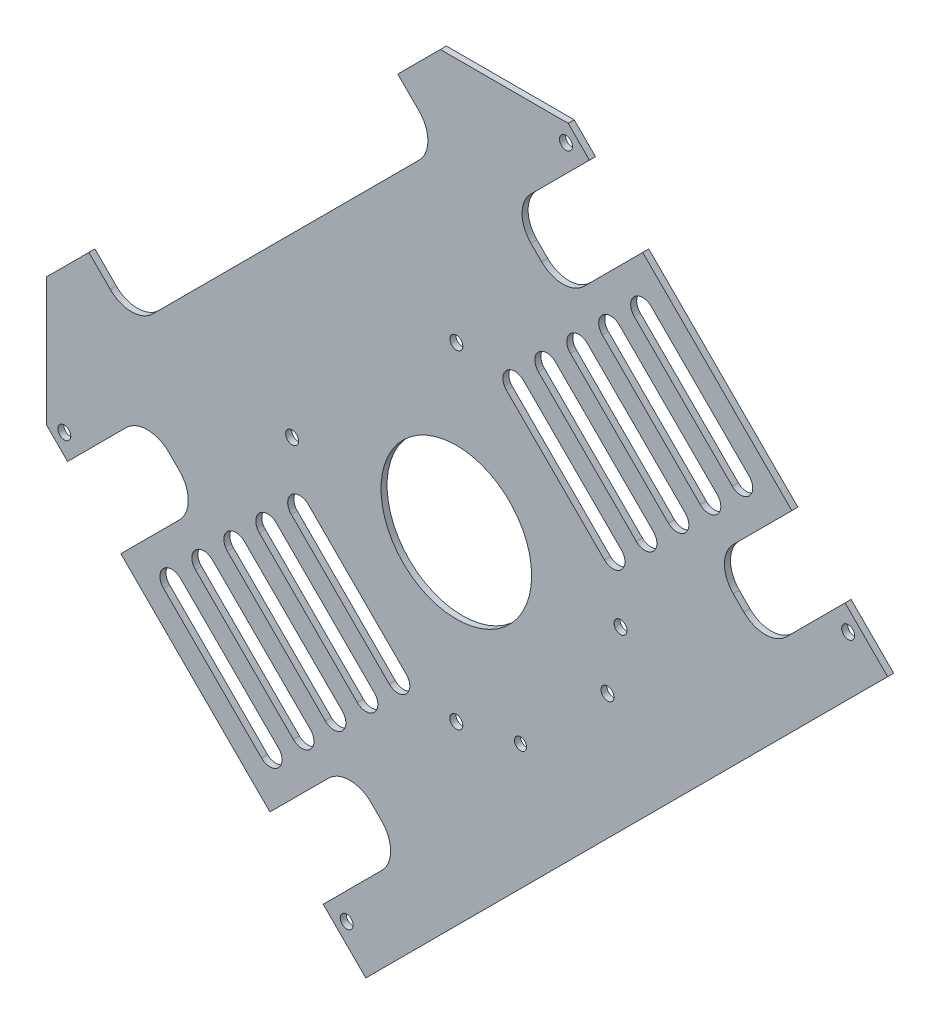
from build123d import *

# Parameters (mm, degrees)
SKETCH1_R          = 2.15
SKETCH1_R_2        = 2
EXTRUDE1_DEPTH     = 2
FILLET1_R          = 10
FILLET2_R          = 10
CHAMFER1_SIZE      = 30
SKETCH3_R          = 2.15
CUT_EXTRUDE1_DEPTH = 3
CUT_EXTRUDE2_DEPTH = 10


with BuildPart() as part:
    # Sketch1 → Extrude1 (new body)
    # profile 1 of 2: a face of its own
    with BuildSketch(Plane.XY):
        with BuildLine():
            Line((-17.67766953, 17.67766953), (-56.568542495, 56.568542495))
            Line((-56.568542495, 56.568542495), (-107.833729857, 5.303355133))
            Line((-107.833729857, 5.303355133), (-121.975865481, 19.445490757))
            Line((-121.975865481, 19.445490757), (-157.33120454, -15.909848303))
            Line((-157.33120454, -15.909848303), (-129.046933293, -44.19411955))
            Line((-129.046933293, -44.19411955), (-102.530428998, -17.677615256))
            Line((-102.530428998, -17.677615256), (-84.852759469, -35.355284785))
            Line((-84.852759469, -35.355284785), (-111.369263763, -61.87178908))
            Line((-111.369263763, -61.87178908), (-110.869178063, -62.37187478))
            Line((-110.869178063, -62.37187478), (-61.87178908, -111.369263763))
            Line((-61.87178908, -111.369263763), (-35.355284785, -84.852759468))
            Line((-35.355284785, -84.852759468), (-17.677615256, -102.530428998))
            Line((-17.677615256, -102.530428998), (-44.19411955, -129.046933293))
            Line((-44.19411955, -129.046933293), (-30.051983927, -143.189068916))
            Line((-30.051983927, -143.189068916), (56.568542495, -56.568542495))
            Line((56.568542495, -56.568542495), (17.67766953, -17.67766953))
            ThreePointArc((17.67766953, -17.67766953), (-17.67766953, -17.67766953), (-17.67766953, 17.67766953))
        make_face()
        with Locations((-54.5, 0)):
            Circle(SKETCH1_R, mode=Mode.SUBTRACT)
        with Locations((0, -54.5)):
            Circle(SKETCH1_R, mode=Mode.SUBTRACT)
        with Locations((21.294846503, -50.167514513)):
            Circle(SKETCH1_R_2, mode=Mode.SUBTRACT)
    # profile 2 of 2: a face of its own
    with BuildSketch(Plane.XY):
        with BuildLine():
            Line((17.677615256, 102.530428998), (44.19411955, 129.046933293))
            Line((44.19411955, 129.046933293), (15.909848303, 157.33120454))
            Line((15.909848303, 157.33120454), (-19.445490757, 121.975865481))
            Line((-19.445490757, 121.975865481), (-5.303355133, 107.833729857))
            Line((-5.303355133, 107.833729857), (-56.568542495, 56.568542495))
            Line((-56.568542495, 56.568542495), (-17.67766953, 17.67766953))
            ThreePointArc((-17.67766953, 17.67766953), (9.567085809, 23.096988313), (25, 0))
            ThreePointArc((25, 0), (23.096988313, -9.567085809), (17.67766953, -17.67766953))
            Line((17.67766953, -17.67766953), (56.568542495, -56.568542495))
            Line((56.568542495, -56.568542495), (143.189068916, 30.051983927))
            Line((143.189068916, 30.051983927), (129.046933293, 44.19411955))
            Line((129.046933293, 44.19411955), (102.530428998, 17.677615256))
            Line((102.530428998, 17.677615256), (84.852759469, 35.355284785))
            Line((84.852759469, 35.355284785), (111.369263763, 61.87178908))
            Line((111.369263763, 61.87178908), (61.87178908, 111.369263763))
            Line((61.87178908, 111.369263763), (35.355284785, 84.852759469))
            Line((35.355284785, 84.852759469), (17.677615256, 102.530428998))
        make_face()
        with Locations((50.167514513, -21.294846503)):
            Circle(SKETCH1_R, mode=Mode.SUBTRACT)
        with Locations((54.5, 0)):
            Circle(SKETCH1_R, mode=Mode.SUBTRACT)
        with Locations((0, 54.5)):
            Circle(SKETCH1_R, mode=Mode.SUBTRACT)
    extrude(amount=EXTRUDE1_DEPTH)

    # Fillet1
    fillet1_edges = [part.edges().sort_by_distance(p)[0] for p in [
        (-107.833729857, 5.303355133, 1),
        (-5.303355133, 107.833729857, 1),
    ]]
    fillet(fillet1_edges, radius=FILLET1_R)

    # Fillet2
    fillet2_edges = [part.edges().sort_by_distance(p)[0] for p in [
        (-17.677615256, -102.530428998, 1),
        (-35.355284785, -84.852759468, 1),
        (-84.852759469, -35.355284785, 1),
        (-102.530428998, -17.677615256, 1),
        (17.677615256, 102.530428998, 1),
        (35.355284785, 84.852759469, 1),
        (84.852759469, 35.355284785, 1),
        (102.530428998, 17.677615256, 1),
    ]]
    fillet(fillet2_edges, radius=FILLET2_R)

    # Chamfer1
    chamfer1_edges = [part.edges().sort_by_distance(p)[0] for p in [
        (-157.33120454, -15.909848303, 1),
        (15.909848303, 157.33120454, 1),
    ]]
    chamfer(chamfer1_edges, length=CHAMFER1_SIZE)

    # Sketch3 → Cut-Extrude1 (cut)
    with BuildSketch(Plane.XY.offset(2)):
        with Locations((130.064043572, 36.323458724)):
            Circle(SKETCH3_R)
        with Locations((36.394169402, 130.13475425)):
            Circle(SKETCH3_R)
        with Locations((-36.3941694, -130.134754248)):
            Circle(SKETCH3_R)
        with Locations((-130.13475425, -36.394169402)):
            Circle(SKETCH3_R)
    extrude(amount=-CUT_EXTRUDE1_DEPTH, mode=Mode.SUBTRACT)

    # Sketch4 → Cut-Extrude2 (cut)
    with BuildSketch(Plane.XY.offset(2)):
        with BuildLine():
            Line((64.700216205, 97.227128139), (97.227128139, 64.700216205))
            ThreePointArc((97.227128139, 64.700216205), (97.227128139, 59.043361955), (91.57027389, 59.043361955))
            Line((91.57027389, 59.043361955), (59.043361955, 91.57027389))
            ThreePointArc((59.043361955, 91.57027389), (59.043361955, 97.227128139), (64.700216205, 97.227128139))
        make_face()
        with BuildLine():
            Line((54.093614487, 86.620526421), (86.620526421, 54.093614487))
            ThreePointArc((86.620526421, 54.093614487), (86.620526421, 48.436760237), (80.963672172, 48.436760237))
            Line((80.963672172, 48.436760237), (48.436760237, 80.963672172))
            ThreePointArc((48.436760237, 80.963672172), (48.436760237, 86.620526421), (54.093614487, 86.620526421))
        make_face()
        with BuildLine():
            Line((43.487012769, 76.013924704), (76.013924704, 43.487012769))
            ThreePointArc((76.013924704, 43.487012769), (76.013924704, 37.83015852), (70.357070454, 37.83015852))
            Line((70.357070454, 37.83015852), (37.83015852, 70.357070454))
            ThreePointArc((37.83015852, 70.357070454), (37.83015852, 76.013924704), (43.487012769, 76.013924704))
        make_face()
        with BuildLine():
            Line((32.880411051, 65.407322986), (65.407322986, 32.880411051))
            ThreePointArc((65.407322986, 32.880411051), (65.407322986, 27.223556802), (59.750468736, 27.223556802))
            Line((59.750468736, 27.223556802), (27.223556802, 59.750468736))
            ThreePointArc((27.223556802, 59.750468736), (27.223556802, 65.407322986), (32.880411051, 65.407322986))
        make_face()
        with BuildLine():
            Line((22.273809333, 54.800721268), (54.800721268, 22.273809333))
            ThreePointArc((54.800721268, 22.273809333), (54.800721268, 16.616955084), (49.143867019, 16.616955084))
            Line((49.143867019, 16.616955084), (16.616955084, 49.143867019))
            ThreePointArc((16.616955084, 49.143867019), (16.616955084, 54.800721268), (22.273809333, 54.800721268))
        make_face()
        with BuildLine():
            Line((-97.227128139, -64.700216205), (-64.700216205, -97.227128139))
            ThreePointArc((-64.700216205, -97.227128139), (-59.043361955, -97.227128139), (-59.043361955, -91.57027389))
            Line((-59.043361955, -91.57027389), (-91.57027389, -59.043361955))
            ThreePointArc((-91.57027389, -59.043361955), (-97.227128139, -59.043361955), (-97.227128139, -64.700216205))
        make_face()
        with BuildLine():
            Line((-86.620526421, -54.093614487), (-54.093614487, -86.620526421))
            ThreePointArc((-54.093614487, -86.620526421), (-48.436760237, -86.620526421), (-48.436760237, -80.963672172))
            Line((-48.436760237, -80.963672172), (-80.963672172, -48.436760237))
            ThreePointArc((-80.963672172, -48.436760237), (-86.620526421, -48.436760237), (-86.620526421, -54.093614487))
        make_face()
        with BuildLine():
            Line((-76.013924704, -43.487012769), (-43.487012769, -76.013924704))
            ThreePointArc((-43.487012769, -76.013924704), (-37.83015852, -76.013924704), (-37.83015852, -70.357070454))
            Line((-37.83015852, -70.357070454), (-70.357070454, -37.83015852))
            ThreePointArc((-70.357070454, -37.83015852), (-76.013924704, -37.83015852), (-76.013924704, -43.487012769))
        make_face()
        with BuildLine():
            Line((-65.407322986, -32.880411051), (-32.880411051, -65.407322986))
            ThreePointArc((-32.880411051, -65.407322986), (-27.223556802, -65.407322986), (-27.223556802, -59.750468736))
            Line((-27.223556802, -59.750468736), (-59.750468736, -27.223556802))
            ThreePointArc((-59.750468736, -27.223556802), (-65.407322986, -27.223556802), (-65.407322986, -32.880411051))
        make_face()
        with BuildLine():
            Line((-54.800721268, -22.273809333), (-22.273809333, -54.800721268))
            ThreePointArc((-22.273809333, -54.800721268), (-16.616955084, -54.800721268), (-16.616955084, -49.143867019))
            Line((-16.616955084, -49.143867019), (-49.143867019, -16.616955084))
            ThreePointArc((-49.143867019, -16.616955084), (-54.800721268, -16.616955084), (-54.800721268, -22.273809333))
        make_face()
    extrude(amount=-CUT_EXTRUDE2_DEPTH, mode=Mode.SUBTRACT)


solid = part.part
